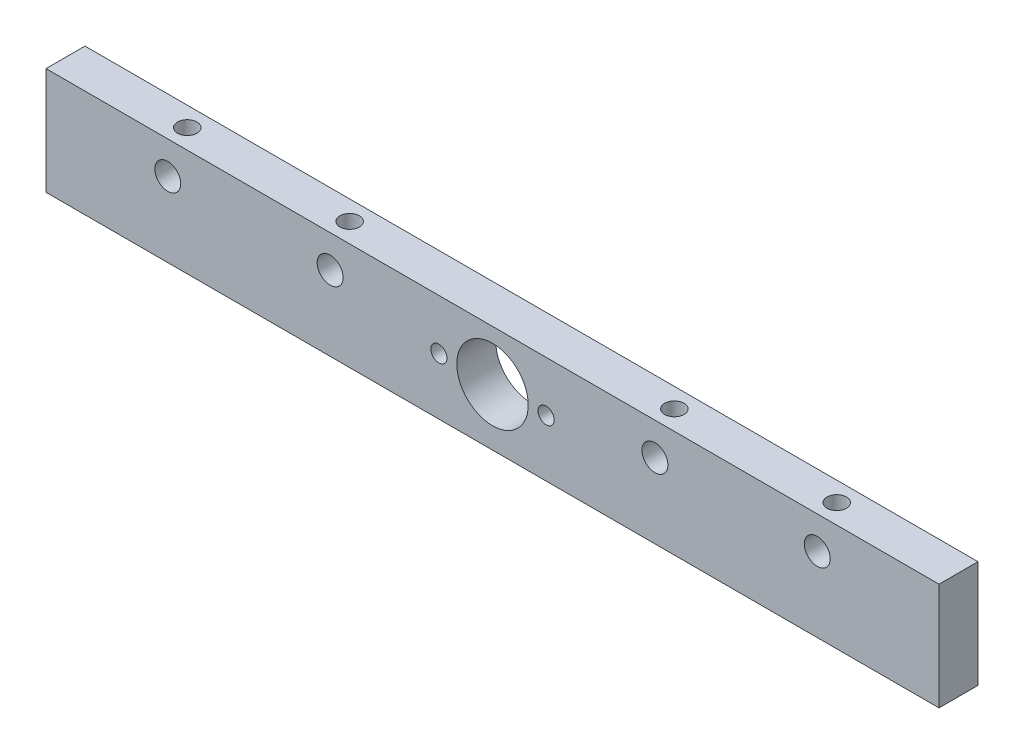
from build123d import *

# Parameters (mm, degrees)
SKETCH1_W           = 275
SKETCH1_H           = 33
BOSS_EXTRUDE1_DEPTH = 12
CUT_EXTRUDE1_REACH  = 141.005
SKETCH2_R           = 11
SKETCH2_R_2         = 2.5
CUT_EXTRUDE2_REACH  = 141.005
SKETCH3_R           = 4
CUT_EXTRUDE3_REACH  = 143.913
SKETCH4_R           = 3


with BuildPart() as part:
    # Sketch1 → Boss-Extrude1 (new body)
    with BuildSketch(Plane.XY):
        Rectangle(SKETCH1_W, SKETCH1_H)
    extrude(amount=BOSS_EXTRUDE1_DEPTH)

    # Sketch2 → Cut-Extrude1 (cut, up to next)
    with BuildSketch(Plane.XY.offset(12), mode=Mode.PRIVATE) as cut_extrude1_sk1:
        with Locations((0, 1)):
            Circle(SKETCH2_R)
    cut_extrude1_tool1 = extrude(cut_extrude1_sk1.sketch, amount=-CUT_EXTRUDE1_REACH, mode=Mode.PRIVATE) & part.part
    # Sketch2 → Cut-Extrude1 (cut, up to next)
    with BuildSketch(Plane.XY.offset(12), mode=Mode.PRIVATE) as cut_extrude1_sk2:
        with Locations((-16.5, 1)):
            Circle(SKETCH2_R_2)
    cut_extrude1_tool2 = extrude(cut_extrude1_sk2.sketch, amount=-CUT_EXTRUDE1_REACH, mode=Mode.PRIVATE) & part.part
    # Sketch2 → Cut-Extrude1 (cut, up to next)
    with BuildSketch(Plane.XY.offset(12), mode=Mode.PRIVATE) as cut_extrude1_sk3:
        with Locations((16.5, 1)):
            Circle(SKETCH2_R_2)
    cut_extrude1_tool3 = extrude(cut_extrude1_sk3.sketch, amount=-CUT_EXTRUDE1_REACH, mode=Mode.PRIVATE) & part.part
    add(cut_extrude1_tool1.solids().sort_by_distance((0, 1, 12))[0], mode=Mode.SUBTRACT)
    add(cut_extrude1_tool2.solids().sort_by_distance((-16.5, 1, 12))[0], mode=Mode.SUBTRACT)
    add(cut_extrude1_tool3.solids().sort_by_distance((16.5, 1, 12))[0], mode=Mode.SUBTRACT)

    # Sketch3 → Cut-Extrude2 (cut, up to next)
    with BuildSketch(Plane.XY.offset(12), mode=Mode.PRIVATE) as cut_extrude2_sk1:
        with Locations((-100, 6.5)):
            Circle(SKETCH3_R)
    cut_extrude2_tool1 = extrude(cut_extrude2_sk1.sketch, amount=-CUT_EXTRUDE2_REACH, mode=Mode.PRIVATE) & part.part
    # Sketch3 → Cut-Extrude2 (cut, up to next)
    with BuildSketch(Plane.XY.offset(12), mode=Mode.PRIVATE) as cut_extrude2_sk2:
        with Locations((-50, 6.5)):
            Circle(SKETCH3_R)
    cut_extrude2_tool2 = extrude(cut_extrude2_sk2.sketch, amount=-CUT_EXTRUDE2_REACH, mode=Mode.PRIVATE) & part.part
    # Sketch3 → Cut-Extrude2 (cut, up to next)
    with BuildSketch(Plane.XY.offset(12), mode=Mode.PRIVATE) as cut_extrude2_sk3:
        with Locations((50, 6.5)):
            Circle(SKETCH3_R)
    cut_extrude2_tool3 = extrude(cut_extrude2_sk3.sketch, amount=-CUT_EXTRUDE2_REACH, mode=Mode.PRIVATE) & part.part
    # Sketch3 → Cut-Extrude2 (cut, up to next)
    with BuildSketch(Plane.XY.offset(12), mode=Mode.PRIVATE) as cut_extrude2_sk4:
        with Locations((100, 6.5)):
            Circle(SKETCH3_R)
    cut_extrude2_tool4 = extrude(cut_extrude2_sk4.sketch, amount=-CUT_EXTRUDE2_REACH, mode=Mode.PRIVATE) & part.part
    add(cut_extrude2_tool1.solids().sort_by_distance((-100, 6.5, 12))[0], mode=Mode.SUBTRACT)
    add(cut_extrude2_tool2.solids().sort_by_distance((-50, 6.5, 12))[0], mode=Mode.SUBTRACT)
    add(cut_extrude2_tool3.solids().sort_by_distance((50, 6.5, 12))[0], mode=Mode.SUBTRACT)
    add(cut_extrude2_tool4.solids().sort_by_distance((100, 6.5, 12))[0], mode=Mode.SUBTRACT)

    # Sketch4 → Cut-Extrude3 (cut, up to next)
    with BuildSketch(Plane(origin=(0, 16.5, 0), x_dir=(1, 0, 0), z_dir=(0, 1, 0)), mode=Mode.PRIVATE) as cut_extrude3_sk1:
        with Locations(Location((-100, -6, 0), (0, 0, 270))):
            Circle(SKETCH4_R)
    cut_extrude3_tool1 = extrude(cut_extrude3_sk1.sketch, amount=-CUT_EXTRUDE3_REACH, mode=Mode.PRIVATE) & part.part
    # Sketch4 → Cut-Extrude3 (cut, up to next)
    with BuildSketch(Plane(origin=(0, 16.5, 0), x_dir=(1, 0, 0), z_dir=(0, 1, 0)), mode=Mode.PRIVATE) as cut_extrude3_sk2:
        with Locations(Location((-50, -6, 0), (0, 0, 270))):
            Circle(SKETCH4_R)
    cut_extrude3_tool2 = extrude(cut_extrude3_sk2.sketch, amount=-CUT_EXTRUDE3_REACH, mode=Mode.PRIVATE) & part.part
    # Sketch4 → Cut-Extrude3 (cut, up to next)
    with BuildSketch(Plane(origin=(0, 16.5, 0), x_dir=(1, 0, 0), z_dir=(0, 1, 0)), mode=Mode.PRIVATE) as cut_extrude3_sk3:
        with Locations(Location((50, -6, 0), (0, 0, 270))):
            Circle(SKETCH4_R)
    cut_extrude3_tool3 = extrude(cut_extrude3_sk3.sketch, amount=-CUT_EXTRUDE3_REACH, mode=Mode.PRIVATE) & part.part
    # Sketch4 → Cut-Extrude3 (cut, up to next)
    with BuildSketch(Plane(origin=(0, 16.5, 0), x_dir=(1, 0, 0), z_dir=(0, 1, 0)), mode=Mode.PRIVATE) as cut_extrude3_sk4:
        with Locations(Location((100, -6, 0), (0, 0, 270))):
            Circle(SKETCH4_R)
    cut_extrude3_tool4 = extrude(cut_extrude3_sk4.sketch, amount=-CUT_EXTRUDE3_REACH, mode=Mode.PRIVATE) & part.part
    add(cut_extrude3_tool1.solids().sort_by_distance((-100, 16.5, 6))[0], mode=Mode.SUBTRACT)
    add(cut_extrude3_tool2.solids().sort_by_distance((-50, 16.5, 6))[0], mode=Mode.SUBTRACT)
    add(cut_extrude3_tool3.solids().sort_by_distance((50, 16.5, 6))[0], mode=Mode.SUBTRACT)
    add(cut_extrude3_tool4.solids().sort_by_distance((100, 16.5, 6))[0], mode=Mode.SUBTRACT)


solid = part.part
